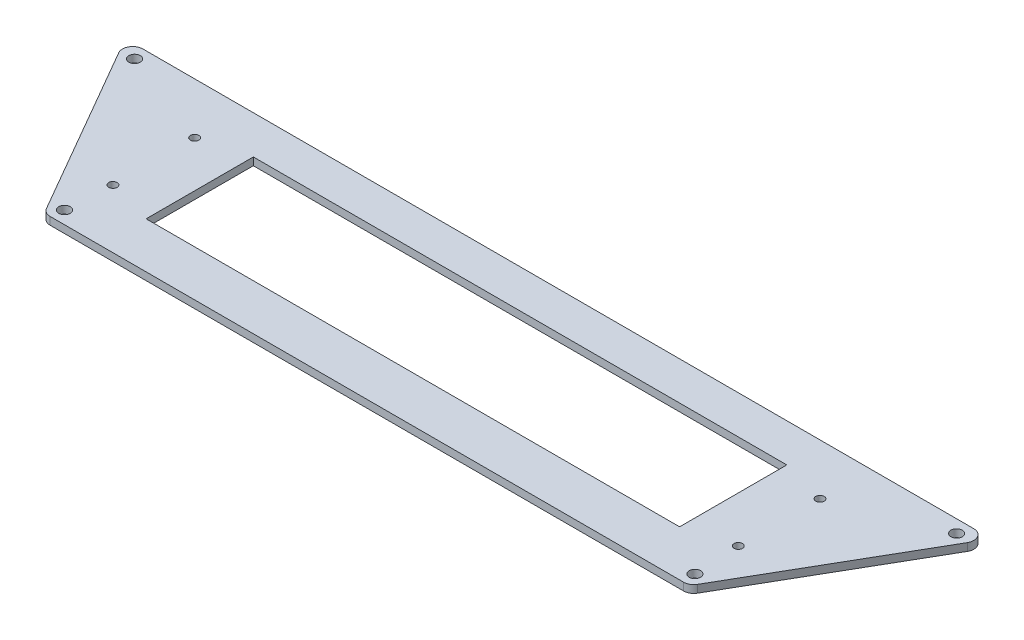
from build123d import *

# Parameters (mm, degrees)
EXTRUDE_1_DEPTH        = 3
HOLE_WIZARD_M4_1_D     = 3.3
HOLE_WIZARD_M4_1_DEPTH = 11.5
HOLE_WIZARD_M4_1_TIP   = 0.991420021
HOLE_WIZARD_M4_2_D     = 4.5
HOLE_WIZARD_M4_2_DEPTH = 8
HOLE_WIZARD_M4_2_TIP   = 1.351936393
FILLET_1_R             = 4
SKETCH_9_W             = 209
SKETCH_9_H             = 42
CUT_EXTRUDE_1_DEPTH    = 172.28583421


with BuildPart() as part:
    # 草图1 → 凸台-拉伸1 (new body)
    with BuildSketch(Plane(origin=(0, 0, 0), x_dir=(1, 0, 0), z_dir=(0, 1, 0))):
        Polygon((-169.688021535, 36), (-126.386751346, -39), (126.386751346, -39), (169.688021535, 36), align=None)
    extrude(amount=EXTRUDE_1_DEPTH)

    # M4 螺纹孔1
    with Locations(Plane(origin=(0, 3, 0), x_dir=(1, 0, 0), z_dir=(0, 1, 0))):
        with Locations((122.5, 16), (-122.5, -16), (-122.5, 16), (122.5, -16)):
            Hole(HOLE_WIZARD_M4_1_D / 2, depth=HOLE_WIZARD_M4_1_DEPTH)
            with Locations((0, 0, -(HOLE_WIZARD_M4_1_DEPTH + HOLE_WIZARD_M4_1_TIP / 2))):  # 118° drill point
                Cone(0, HOLE_WIZARD_M4_1_D / 2, HOLE_WIZARD_M4_1_TIP, mode=Mode.SUBTRACT)

    # M4 间隙孔2
    with Locations(Plane(origin=(0, 0, 0), x_dir=(-1, 0, 0), z_dir=(0, -1, 0))):
        with Locations((-123.5, -34), (123.5, -34), (161.027767497, 31), (-161.027767497, 31)):
            Hole(HOLE_WIZARD_M4_2_D / 2, depth=HOLE_WIZARD_M4_2_DEPTH)
            with Locations((0, 0, -(HOLE_WIZARD_M4_2_DEPTH + HOLE_WIZARD_M4_2_TIP / 2))):  # 118° drill point
                Cone(0, HOLE_WIZARD_M4_2_D / 2, HOLE_WIZARD_M4_2_TIP, mode=Mode.SUBTRACT)

    # 圆角1
    fillet_1_edges = [part.edges().sort_by_distance(p)[0] for p in [
        (169.688021535, 1.5, -36),
        (126.386751346, 1.5, 39),
        (-126.386751346, 1.5, 39),
        (-169.688021535, 1.5, -36),
    ]]
    fillet(fillet_1_edges, radius=FILLET_1_R)

    # 草图9 → 切除-拉伸1 (cut, through all)
    with BuildSketch(Plane.XZ):
        Rectangle(SKETCH_9_W, SKETCH_9_H)
    extrude(amount=-CUT_EXTRUDE_1_DEPTH, mode=Mode.SUBTRACT)


solid = part.part
